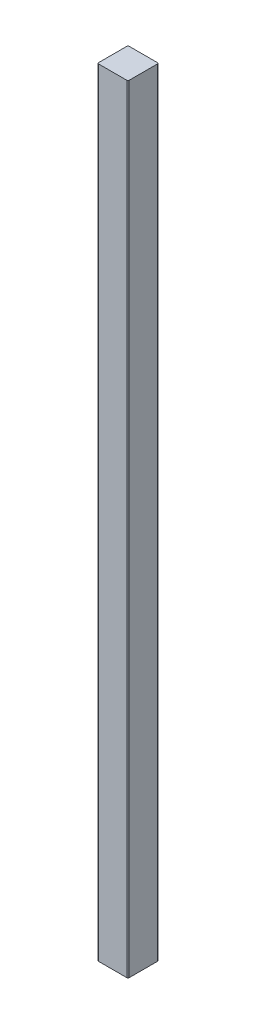
from build123d import *

# Parameters (mm, degrees)
SKETCH1_W           = 88.9
SKETCH1_H           = 88.9
BOSS_EXTRUDE1_DEPTH = 2260.6
FILLET1_R           = 3.175


with BuildPart() as part:
    # Sketch1 → Boss-Extrude1 (new body)
    with BuildSketch(Plane(origin=(0, 0, 0), x_dir=(1, 0, 0), z_dir=(0, 1, 0))):
        Rectangle(SKETCH1_W, SKETCH1_H)
    extrude(amount=BOSS_EXTRUDE1_DEPTH)

    # Fillet1
    fillet1_edges = [part.edges().sort_by_distance(p)[0] for p in [
        (44.45, 1130.3, 44.45),
        (-44.45, 1130.3, 44.45),
        (-44.45, 1130.3, -44.45),
        (44.45, 1130.3, -44.45),
    ]]
    fillet(fillet1_edges, radius=FILLET1_R)


solid = part.part
